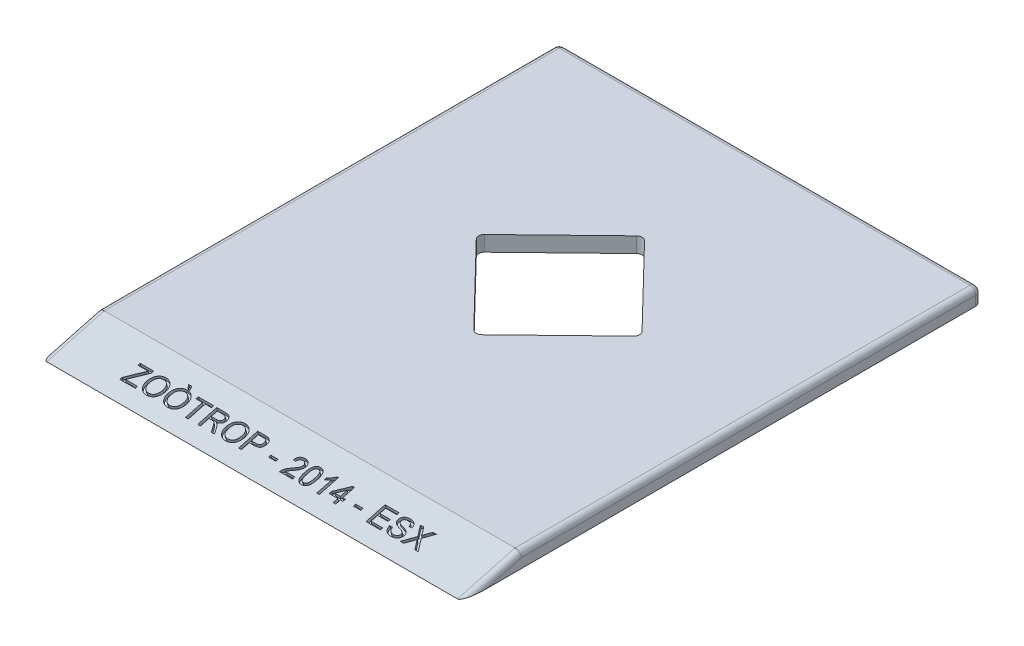
from build123d import *

# Parameters (mm, degrees)
SALIENTE_EXTRUIR1_DEPTH = 55
CROQUIS3_W              = 1.909775432
CROQUIS3_H              = 0.592688927
CORTAR_EXTRUIR1_DEPTH   = 0.8
CORTAR_EXTRUIR2_DEPTH   = 21
REDONDEO1_R             = 1.5
REDONDEO2_R             = 1.5


with BuildPart() as part:
    # Croquis2 → Saliente-Extruir1 (new, symmetric)
    with BuildSketch(Plane(origin=(0, 0, 0), x_dir=(0, 0, -1), z_dir=(1, 0, 0))):
        Polygon((55, 0), (-80, 0), (-65, 4), (55, 4), align=None)
    extrude(amount=SALIENTE_EXTRUIR1_DEPTH, both=True)

    # Croquis3 → Cortar-Extruir1 (cut)
    # profile 1 of 17: a face of its own
    with BuildSketch(Plane(origin=(0, 19.917012448, 5.31120332), x_dir=(1, 0, 0), z_dir=(0, 0.9662349396012462, 0.2576626505603331))):
        with BuildLine():
            Line((-38.821124737, -72.774620472), (-38.821124737, -72.157236173))
            Line((-38.821124737, -72.157236173), (-36.291907058, -68.820274035))
            add(Edge.make_bspline(
                [(-36.291907058, -68.820274035), (-36.248925844, -68.764104905), (-36.166507957, -68.656398756), (-36.050100088, -68.500769581), (-35.9424882, -68.361461879), (-35.875768236, -68.27258562), (-35.844303441, -68.230672029)],
                knots=[0, 0, 0, 0, 1.146521337, 2.198492228, 3.150418105, 4, 4, 4, 4], degree=3))
            Line((-35.844303441, -68.230672029), (-38.491853111, -68.230672029))
            Line((-38.491853111, -68.230672029), (-38.491853111, -67.637983102))
            Line((-38.491853111, -67.637983102), (-34.935719547, -67.637983102))
            Line((-34.935719547, -67.637983102), (-34.935719547, -68.230672029))
            Line((-34.935719547, -68.230672029), (-37.679992757, -71.851630944))
            Line((-37.679992757, -71.851630944), (-37.930033398, -72.181931545))
            Line((-37.930033398, -72.181931545), (-34.804010897, -72.181931545))
            Line((-34.804010897, -72.181931545), (-34.804010897, -72.774620472))
            Line((-34.804010897, -72.774620472), (-38.821124737, -72.774620472))
        make_face()
    # profile 2 of 17: a face of its own
    with BuildSketch(Plane(origin=(0, 19.917012448, 5.31120332), x_dir=(1, 0, 0), z_dir=(0, 0.9662349396012462, 0.2576626505603331))):
        with BuildLine():
            add(Edge.make_bspline(
                [(-34.277176295, -70.27421406), (-34.275390997, -70.171228908), (-34.271912435, -69.970567562), (-34.23941036, -69.678378787), (-34.186635331, -69.40346737), (-34.111188758, -69.145854728), (-34.015560009, -68.905137182), (-33.899304998, -68.680769663), (-33.758926849, -68.475291849), (-33.600123391, -68.286747726), (-33.422747222, -68.120060901), (-33.233892017, -67.972019119), (-33.031199568, -67.848534771), (-32.816542595, -67.746577409), (-32.589009116, -67.668297499), (-32.349237974, -67.613494439), (-32.097485604, -67.578141139), (-31.925406967, -67.574162008), (-31.837479339, -67.572128777)],
                knots=[0, 0, 0, 0, 1.203621547, 2.345195544, 3.432004029, 4.472479546, 5.478447225, 6.455936844, 7.420185704, 8.381829745, 9.332027588, 10.260832629, 11.182364398, 12.100723901, 13.034044877, 13.989196293, 14.972532542, 16, 16, 16, 16], degree=3))
            add(Edge.make_bspline(
                [(-31.837479339, -67.572128777), (-31.779485026, -67.573141467), (-31.664318811, -67.575152486), (-31.49405584, -67.590453654), (-31.328168029, -67.617763589), (-31.166818735, -67.654361964), (-31.009568765, -67.70237744), (-30.856324212, -67.75905825), (-30.70842656, -67.829293753), (-30.564891887, -67.907929388), (-30.427414512, -67.995886747), (-30.29821362, -68.093053062), (-30.177598687, -68.19869347), (-30.063949527, -68.311071529), (-29.961058453, -68.433979844), (-29.864674773, -68.563674415), (-29.777568129, -68.702454938), (-29.699429447, -68.849184341), (-29.629565525, -69.001596416), (-29.569853312, -69.160322848), (-29.518579525, -69.323459604), (-29.475659039, -69.491972277), (-29.444862433, -69.66580326), (-29.420338762, -69.844203531), (-29.407431276, -70.027756162), (-29.405124348, -70.151749236), (-29.403956226, -70.214533578)],
                knots=[0, 0, 0, 0, 1.034375294, 2.054082248, 3.045783978, 4.031219655, 5.002789406, 5.976610191, 6.94273282, 7.920236376, 8.894345378, 9.851183672, 10.800797181, 11.752517031, 12.698794154, 13.65688337, 14.632873302, 15.61821402, 16.620222298, 17.621258913, 18.640965868, 19.669244166, 20.720417492, 21.788124603, 22.880008887, 24, 24, 24, 24], degree=3))
            add(Edge.make_bspline(
                [(-29.403956226, -70.214533578), (-29.40502648, -70.278353234), (-29.407140951, -70.404439971), (-29.421448327, -70.590708658), (-29.446605668, -70.771629957), (-29.479972598, -70.947743343), (-29.524683265, -71.118682185), (-29.577815022, -71.284936574), (-29.642080883, -71.445516266), (-29.714662039, -71.600808292), (-29.796787586, -71.748676848), (-29.887377636, -71.888087966), (-29.986496368, -72.017737565), (-30.092638179, -72.139216116), (-30.208281762, -72.250351355), (-30.332003123, -72.352182478), (-30.463326555, -72.445669867), (-30.602693238, -72.528281593), (-30.747602047, -72.600693721), (-30.895185465, -72.664936325), (-31.04555312, -72.719724974), (-31.199218922, -72.764125728), (-31.355763687, -72.797678134), (-31.514746878, -72.822802529), (-31.676689666, -72.837269242), (-31.785660027, -72.839400788), (-31.84056626, -72.840474797)],
                knots=[0, 0, 0, 0, 1.141429366, 2.255090526, 3.338676798, 4.407031443, 5.458968682, 6.496860253, 7.526652771, 8.550250826, 9.560787671, 10.54935636, 11.521089193, 12.477323897, 13.431786008, 14.386110112, 15.340986122, 16.312041, 17.28047646, 18.236612773, 19.189437236, 20.140779471, 21.09494583, 22.051062463, 23.018000708, 24, 24, 24, 24], degree=3))
            add(Edge.make_bspline(
                [(-31.84056626, -72.840474797), (-31.899602655, -72.839601346), (-32.016538969, -72.837871259), (-32.189373989, -72.820602039), (-32.357909146, -72.794257243), (-32.521654478, -72.756223316), (-32.680386233, -72.706605371), (-32.834292227, -72.646549381), (-32.983913763, -72.576857974), (-33.127394287, -72.495535658), (-33.264245449, -72.405113985), (-33.393140838, -72.306042436), (-33.514009179, -72.199234043), (-33.624911031, -72.082923392), (-33.729438156, -71.961326788), (-33.823411089, -71.829924561), (-33.909898839, -71.691696777), (-33.986342093, -71.545310978), (-34.055397134, -71.395117197), (-34.113577497, -71.241067389), (-34.16470676, -71.08543184), (-34.205426043, -70.927251278), (-34.237874356, -70.766890588), (-34.259693495, -70.604616606), (-34.275451443, -70.440187651), (-34.276598451, -70.329817002), (-34.277176295, -70.27421406)],
                knots=[0, 0, 0, 0, 1.072727997, 2.12480551, 3.153819198, 4.171534612, 5.177148798, 6.173931848, 7.17235114, 8.174500385, 9.168706755, 10.151274001, 11.127173509, 12.097141049, 13.070188938, 14.039134204, 15.03036519, 16.031505612, 17.038625933, 18.033164522, 19.022845559, 20.014762458, 21.000193215, 21.994692725, 22.989758729, 24, 24, 24, 24], degree=3))
        make_face()
        with BuildLine():
            add(Edge.make_bspline(
                [(-33.552778717, -70.282445851), (-33.551668612, -70.356604452), (-33.549503985, -70.501208491), (-33.524739489, -70.71203349), (-33.48716332, -70.910957613), (-33.435368538, -71.098539288), (-33.365743667, -71.27292336), (-33.282498119, -71.435785489), (-33.182828997, -71.586043063), (-33.068935298, -71.72327575), (-32.943665286, -71.846555313), (-32.809801566, -71.954233454), (-32.667314044, -72.04440628), (-32.51778245, -72.118863198), (-32.360132766, -72.176983611), (-32.194837157, -72.217794301), (-32.021774171, -72.243318075), (-31.903766557, -72.246278051), (-31.843653182, -72.24778587)],
                knots=[0, 0, 0, 0, 1.215430442, 2.370003584, 3.475209778, 4.53279855, 5.55522989, 6.548792651, 7.526809858, 8.505409025, 9.467826767, 10.404123909, 11.316848639, 12.227335424, 13.138360512, 14.065900994, 15.014765094, 16, 16, 16, 16], degree=3))
            add(Edge.make_bspline(
                [(-31.843653182, -72.24778587), (-31.782520881, -72.246255749), (-31.66282401, -72.243259777), (-31.487151865, -72.218181567), (-31.320243662, -72.175486985), (-31.160445042, -72.118650823), (-31.010645011, -72.041818022), (-30.867340172, -71.951847233), (-30.734437035, -71.841905505), (-30.608673204, -71.718407909), (-30.495871519, -71.57803021), (-30.39578377, -71.424230356), (-30.314479528, -71.254701742), (-30.244284289, -71.073178851), (-30.192883289, -70.87623083), (-30.1548948, -70.666096584), (-30.132002132, -70.442100176), (-30.129591416, -70.288330798), (-30.128353804, -70.209388708)],
                knots=[0, 0, 0, 0, 0.976878588, 1.912725521, 2.8289017, 3.727303729, 4.617335839, 5.514666588, 6.426584173, 7.368641557, 8.327632997, 9.299405846, 10.294892156, 11.327373912, 12.405931897, 13.542618837, 14.738430195, 16, 16, 16, 16], degree=3))
            add(Edge.make_bspline(
                [(-30.128353804, -70.209388708), (-30.128791175, -70.158602506), (-30.129649141, -70.058978356), (-30.141011478, -69.912131219), (-30.155667435, -69.769851869), (-30.177981357, -69.632323897), (-30.208732773, -69.500116837), (-30.242800119, -69.372224196), (-30.285400145, -69.24974808), (-30.33373581, -69.132208186), (-30.387822602, -69.02020794), (-30.44882531, -68.914691551), (-30.516034957, -68.816069241), (-30.587638148, -68.722471233), (-30.667599864, -68.637520152), (-30.752069901, -68.557627625), (-30.842966992, -68.484444249), (-30.939384017, -68.417950908), (-31.039953178, -68.358096421), (-31.144467149, -68.306868747), (-31.251260876, -68.261871671), (-31.362121934, -68.227379524), (-31.475519546, -68.199561102), (-31.591912126, -68.178430418), (-31.71173169, -68.167487967), (-31.792528374, -68.165714184), (-31.833363443, -68.164817704)],
                knots=[0, 0, 0, 0, 1.220438779, 2.394059227, 3.538503547, 4.658058814, 5.74010225, 6.800155734, 7.837851593, 8.854470756, 9.853724944, 10.825214244, 11.781044712, 12.72106398, 13.654479919, 14.581868691, 15.514082315, 16.456304431, 17.39516604, 18.324312202, 19.252140633, 20.177768678, 21.111585046, 22.057694709, 23.018348693, 24, 24, 24, 24], degree=3))
            add(Edge.make_bspline(
                [(-31.833363443, -68.164817704), (-31.891078243, -68.165963897), (-32.004955973, -68.168225464), (-32.172597549, -68.19336629), (-32.334222205, -68.23093012), (-32.490080764, -68.283446355), (-32.638840193, -68.352986104), (-32.781271202, -68.43826709), (-32.918638074, -68.536967245), (-33.04877473, -68.651491376), (-33.170090558, -68.783051647), (-33.27265092, -68.938157175), (-33.359091595, -69.113105265), (-33.431267966, -69.307452465), (-33.486300323, -69.522703865), (-33.524334566, -69.757933137), (-33.548348611, -70.013388156), (-33.551264263, -70.19046713), (-33.552778717, -70.282445851)],
                knots=[0, 0, 0, 0, 0.895090134, 1.766112571, 2.624765742, 3.468151641, 4.313618154, 5.168136083, 6.041303099, 6.935189387, 7.854749729, 8.809996334, 9.809869957, 10.877771942, 12.021723904, 13.25217762, 14.572720513, 16, 16, 16, 16], degree=3))
        make_face(mode=Mode.SUBTRACT)
    # profile 3 of 17: a face of its own
    with BuildSketch(Plane(origin=(0, 19.917012448, 5.31120332), x_dir=(1, 0, 0), z_dir=(0, 0.9662349396012462, 0.2576626505603331))):
        with BuildLine():
            add(Edge.make_bspline(
                [(-28.745412973, -70.27421406), (-28.743627676, -70.171228908), (-28.740149114, -69.970567562), (-28.707647038, -69.678378787), (-28.65487201, -69.40346737), (-28.579425436, -69.145854728), (-28.483796688, -68.905137182), (-28.367541676, -68.680769663), (-28.227163528, -68.475291849), (-28.06836007, -68.286747726), (-27.890983901, -68.120060901), (-27.702128696, -67.972019119), (-27.499436246, -67.848534771), (-27.284779274, -67.746577409), (-27.057245795, -67.668297499), (-26.817474653, -67.613494439), (-26.565722282, -67.578141139), (-26.393643645, -67.574162008), (-26.305716017, -67.572128777)],
                knots=[0, 0, 0, 0, 1.203621547, 2.345195544, 3.432004029, 4.472479546, 5.478447225, 6.455936844, 7.420185704, 8.381829745, 9.332027588, 10.260832629, 11.182364398, 12.100723901, 13.034044877, 13.989196293, 14.972532542, 16, 16, 16, 16], degree=3))
            add(Edge.make_bspline(
                [(-26.305716017, -67.572128777), (-26.247721705, -67.573141467), (-26.132555489, -67.575152486), (-25.962292519, -67.590453654), (-25.796404707, -67.617763589), (-25.635055414, -67.654361964), (-25.477805443, -67.70237744), (-25.32456089, -67.75905825), (-25.176663239, -67.829293753), (-25.033128566, -67.907929388), (-24.895651191, -67.995886747), (-24.766450299, -68.093053062), (-24.645835365, -68.19869347), (-24.532186206, -68.311071529), (-24.429295132, -68.433979844), (-24.332911452, -68.563674415), (-24.245804808, -68.702454938), (-24.167666126, -68.849184341), (-24.097802204, -69.001596416), (-24.038089991, -69.160322848), (-23.986816204, -69.323459604), (-23.943895718, -69.491972277), (-23.913099111, -69.66580326), (-23.888575441, -69.844203531), (-23.875667955, -70.027756162), (-23.873361026, -70.151749236), (-23.872192904, -70.214533578)],
                knots=[0, 0, 0, 0, 1.034375294, 2.054082248, 3.045783978, 4.031219655, 5.002789406, 5.976610191, 6.94273282, 7.920236376, 8.894345378, 9.851183672, 10.800797181, 11.752517031, 12.698794154, 13.65688337, 14.632873302, 15.61821402, 16.620222298, 17.621258913, 18.640965868, 19.669244166, 20.720417492, 21.788124603, 22.880008887, 24, 24, 24, 24], degree=3))
            add(Edge.make_bspline(
                [(-23.872192904, -70.214533578), (-23.873263158, -70.278353234), (-23.875377629, -70.404439971), (-23.889685006, -70.590708658), (-23.914842347, -70.771629957), (-23.948209276, -70.947743343), (-23.992919943, -71.118682185), (-24.0460517, -71.284936574), (-24.110317562, -71.445516266), (-24.182898717, -71.600808292), (-24.265024264, -71.748676848), (-24.355614315, -71.888087966), (-24.454733047, -72.017737565), (-24.560874858, -72.139216116), (-24.67651844, -72.250351355), (-24.800239802, -72.352182478), (-24.931563234, -72.445669867), (-25.070929917, -72.528281593), (-25.215838726, -72.600693721), (-25.363422144, -72.664936325), (-25.513789798, -72.719724974), (-25.667455601, -72.764125728), (-25.824000365, -72.797678134), (-25.982983557, -72.822802529), (-26.144926345, -72.837269242), (-26.253896706, -72.839400788), (-26.308802939, -72.840474797)],
                knots=[0, 0, 0, 0, 1.141429366, 2.255090526, 3.338676798, 4.407031443, 5.458968682, 6.496860253, 7.526652771, 8.550250826, 9.560787671, 10.54935636, 11.521089193, 12.477323897, 13.431786008, 14.386110112, 15.340986122, 16.312041, 17.28047646, 18.236612773, 19.189437236, 20.140779471, 21.09494583, 22.051062463, 23.018000708, 24, 24, 24, 24], degree=3))
            add(Edge.make_bspline(
                [(-26.308802939, -72.840474797), (-26.367839334, -72.839601346), (-26.484775647, -72.837871259), (-26.657610668, -72.820602039), (-26.826145825, -72.794257243), (-26.989891157, -72.756223316), (-27.148622911, -72.706605371), (-27.302528905, -72.646549381), (-27.452150442, -72.576857974), (-27.595630966, -72.495535658), (-27.732482127, -72.405113985), (-27.861377516, -72.306042436), (-27.982245858, -72.199234043), (-28.09314771, -72.082923392), (-28.197674834, -71.961326788), (-28.291647767, -71.829924561), (-28.378135518, -71.691696777), (-28.454578772, -71.545310978), (-28.523633812, -71.395117197), (-28.581814175, -71.241067389), (-28.632943439, -71.08543184), (-28.673662721, -70.927251278), (-28.706111034, -70.766890588), (-28.727930174, -70.604616606), (-28.743688122, -70.440187651), (-28.744835129, -70.329817002), (-28.745412973, -70.27421406)],
                knots=[0, 0, 0, 0, 1.072727997, 2.12480551, 3.153819198, 4.171534612, 5.177148798, 6.173931848, 7.17235114, 8.174500385, 9.168706755, 10.151274001, 11.127173509, 12.097141049, 13.070188938, 14.039134204, 15.03036519, 16.031505612, 17.038625933, 18.033164522, 19.022845559, 20.014762458, 21.000193215, 21.994692725, 22.989758729, 24, 24, 24, 24], degree=3))
        make_face()
        with BuildLine():
            add(Edge.make_bspline(
                [(-28.021015395, -70.282445851), (-28.019905291, -70.356604452), (-28.017740664, -70.501208491), (-27.992976167, -70.71203349), (-27.955399999, -70.910957613), (-27.903605217, -71.098539288), (-27.833980346, -71.27292336), (-27.750734798, -71.435785489), (-27.651065676, -71.586043063), (-27.537171977, -71.72327575), (-27.411901965, -71.846555313), (-27.278038244, -71.954233454), (-27.135550723, -72.04440628), (-26.986019128, -72.118863198), (-26.828369445, -72.176983611), (-26.663073836, -72.217794301), (-26.49001085, -72.243318075), (-26.372003236, -72.246278051), (-26.31188986, -72.24778587)],
                knots=[0, 0, 0, 0, 1.215430442, 2.370003584, 3.475209778, 4.53279855, 5.55522989, 6.548792651, 7.526809858, 8.505409025, 9.467826767, 10.404123909, 11.316848639, 12.227335424, 13.138360512, 14.065900994, 15.014765094, 16, 16, 16, 16], degree=3))
            add(Edge.make_bspline(
                [(-26.31188986, -72.24778587), (-26.25075756, -72.246255749), (-26.131060688, -72.243259777), (-25.955388543, -72.218181567), (-25.78848034, -72.175486985), (-25.628681721, -72.118650823), (-25.478881689, -72.041818022), (-25.335576851, -71.951847233), (-25.202673714, -71.841905505), (-25.076909882, -71.718407909), (-24.964108197, -71.57803021), (-24.864020449, -71.424230356), (-24.782716207, -71.254701742), (-24.712520967, -71.073178851), (-24.661119967, -70.87623083), (-24.623131479, -70.666096584), (-24.600238811, -70.442100176), (-24.597828095, -70.288330798), (-24.596590482, -70.209388708)],
                knots=[0, 0, 0, 0, 0.976878588, 1.912725521, 2.8289017, 3.727303729, 4.617335839, 5.514666588, 6.426584173, 7.368641557, 8.327632997, 9.299405846, 10.294892156, 11.327373912, 12.405931897, 13.542618837, 14.738430195, 16, 16, 16, 16], degree=3))
            add(Edge.make_bspline(
                [(-24.596590482, -70.209388708), (-24.597027854, -70.158602506), (-24.59788582, -70.058978356), (-24.609248157, -69.912131219), (-24.623904113, -69.769851869), (-24.646218035, -69.632323897), (-24.676969451, -69.500116837), (-24.711036798, -69.372224196), (-24.753636823, -69.24974808), (-24.801972489, -69.132208186), (-24.856059281, -69.02020794), (-24.917061988, -68.914691551), (-24.984271635, -68.816069241), (-25.055874827, -68.722471233), (-25.135836543, -68.637520152), (-25.220306579, -68.557627625), (-25.31120367, -68.484444249), (-25.407620696, -68.417950908), (-25.508189856, -68.358096421), (-25.612703828, -68.306868747), (-25.719497555, -68.261871671), (-25.830358613, -68.227379524), (-25.943756225, -68.199561102), (-26.060148804, -68.178430418), (-26.179968369, -68.167487967), (-26.260765053, -68.165714184), (-26.301600122, -68.164817704)],
                knots=[0, 0, 0, 0, 1.220438779, 2.394059227, 3.538503547, 4.658058814, 5.74010225, 6.800155734, 7.837851593, 8.854470756, 9.853724944, 10.825214244, 11.781044712, 12.72106398, 13.654479919, 14.581868691, 15.514082315, 16.456304431, 17.39516604, 18.324312202, 19.252140633, 20.177768678, 21.111585046, 22.057694709, 23.018348693, 24, 24, 24, 24], degree=3))
            add(Edge.make_bspline(
                [(-26.301600122, -68.164817704), (-26.359314922, -68.165963897), (-26.473192652, -68.168225464), (-26.640834228, -68.19336629), (-26.802458884, -68.23093012), (-26.958317443, -68.283446355), (-27.107076872, -68.352986104), (-27.249507881, -68.43826709), (-27.386874753, -68.536967245), (-27.517011408, -68.651491376), (-27.638327236, -68.783051647), (-27.740887598, -68.938157175), (-27.827328273, -69.113105265), (-27.899504644, -69.307452465), (-27.954537002, -69.522703865), (-27.992571245, -69.757933137), (-28.016585289, -70.013388156), (-28.019500942, -70.19046713), (-28.021015395, -70.282445851)],
                knots=[0, 0, 0, 0, 0.895090134, 1.766112571, 2.624765742, 3.468151641, 4.313618154, 5.168136083, 6.041303099, 6.935189387, 7.854749729, 8.809996334, 9.809869957, 10.877771942, 12.021723904, 13.25217762, 14.572720513, 16, 16, 16, 16], degree=3))
        make_face(mode=Mode.SUBTRACT)
    # profile 4 of 17: a face of its own
    with BuildSketch(Plane(origin=(0, 19.917012448, 5.31120332), x_dir=(1, 0, 0), z_dir=(0, 0.9662349396012462, 0.2576626505603331))):
        Polygon((-25.847822662, -67.374565801), (-26.308802939, -67.374565801), (-27.099054842, -66.386750922), (-26.242948614, -66.386750922), align=None)
    # profile 5 of 17: a face of its own
    with BuildSketch(Plane(origin=(0, 19.917012448, 5.31120332), x_dir=(1, 0, 0), z_dir=(0, 0.9662349396012462, 0.2576626505603331))):
        Polygon((-21.699000171, -72.774620472), (-21.699000171, -68.230672029), (-23.345358302, -68.230672029), (-23.345358302, -67.637983102), (-19.328244462, -67.637983102), (-19.328244462, -68.230672029), (-20.974602593, -68.230672029), (-20.974602593, -72.774620472), align=None)
    # profile 6 of 17: a face of its own
    with BuildSketch(Plane(origin=(0, 19.917012448, 5.31120332), x_dir=(1, 0, 0), z_dir=(0, 0.9662349396012462, 0.2576626505603331))):
        with BuildLine():
            Line((-18.537992559, -72.774620472), (-18.537992559, -67.637983102))
            Line((-18.537992559, -67.637983102), (-16.309235239, -67.637983102))
            add(Edge.make_bspline(
                [(-16.309235239, -67.637983102), (-16.256754828, -67.638394308), (-16.155185136, -67.639190148), (-16.007888111, -67.644823796), (-15.870401105, -67.656968462), (-15.742471324, -67.670101225), (-15.624121499, -67.690258263), (-15.515473728, -67.71337793), (-15.416360264, -67.740890684), (-15.326338009, -67.773385367), (-15.242816987, -67.810148233), (-15.165399308, -67.855507674), (-15.090866819, -67.905211949), (-15.021985681, -67.963607055), (-14.956939147, -68.027544291), (-14.895787505, -68.097892429), (-14.839436055, -68.175261947), (-14.769933291, -68.285993772), (-14.695370995, -68.433465244), (-14.633248891, -68.622196775), (-14.59319367, -68.819616845), (-14.588907646, -68.954530593), (-14.586733044, -69.02298188)],
                knots=[0, 0, 0, 0, 1.242255013, 2.404239178, 3.487702428, 4.508875116, 5.447164253, 6.327763259, 7.137389581, 7.87956647, 8.591787438, 9.293660819, 10.000726923, 10.709654955, 11.427269343, 12.158170644, 12.913245971, 13.690346794, 15.251572448, 16.809945773, 18.381459854, 20, 20, 20, 20], degree=3))
            add(Edge.make_bspline(
                [(-14.586733044, -69.02298188), (-14.587738194, -69.066921502), (-14.589723436, -69.153705267), (-14.604930586, -69.281300633), (-14.632446696, -69.403212873), (-14.667730683, -69.520509675), (-14.716023698, -69.631529129), (-14.77196906, -69.738538842), (-14.841277409, -69.838598972), (-14.918875769, -69.934373959), (-15.00786028, -70.023812559), (-15.109013736, -70.103688047), (-15.221333425, -70.175536209), (-15.345348329, -70.237374725), (-15.479630911, -70.293898064), (-15.625866049, -70.339413381), (-15.783463549, -70.376580127), (-15.892717463, -70.3945777), (-15.949094397, -70.403864763)],
                knots=[0, 0, 0, 0, 0.982609109, 1.940720374, 2.867584677, 3.775009516, 4.675469332, 5.571146231, 6.471115823, 7.392408543, 8.32534739, 9.286126426, 10.269214477, 11.301811357, 12.381622301, 13.524260118, 14.722474812, 16, 16, 16, 16], degree=3))
            add(Edge.make_bspline(
                [(-15.949094397, -70.403864763), (-15.90773978, -70.424756203), (-15.829205872, -70.464429801), (-15.720474704, -70.526637658), (-15.628307057, -70.590198758), (-15.574909669, -70.635659525), (-15.549852551, -70.656992325)],
                knots=[0, 0, 0, 0, 1.172304973, 2.226249348, 3.167654437, 4, 4, 4, 4], degree=3))
            add(Edge.make_bspline(
                [(-15.549852551, -70.656992325), (-15.501328026, -70.70456054), (-15.401655205, -70.802269032), (-15.264301728, -70.968695217), (-15.131132815, -71.153953099), (-15.05022266, -71.287839597), (-15.008612315, -71.356694531)],
                knots=[0, 0, 0, 0, 0.918110279, 1.885863737, 2.912745394, 4, 4, 4, 4], degree=3))
            Line((-15.008612315, -71.356694531), (-14.165882746, -72.774620472))
            Line((-14.165882746, -72.774620472), (-14.996264629, -72.774620472))
            Line((-14.996264629, -72.774620472), (-15.636286352, -71.690082053))
            add(Edge.make_bspline(
                [(-15.636286352, -71.690082053), (-15.659298319, -71.652029719), (-15.703891731, -71.578290544), (-15.768305318, -71.470598028), (-15.831460721, -71.371449908), (-15.890036278, -71.278012477), (-15.946409082, -71.191982046), (-16.00003444, -71.11305976), (-16.049436558, -71.040210264), (-16.110627469, -70.955394492), (-16.181843525, -70.861545053), (-16.264947777, -70.764897853), (-16.344087664, -70.687842328), (-16.441549895, -70.612281189), (-16.562271614, -70.541606444), (-16.664887354, -70.50913334), (-16.714650928, -70.493385486)],
                knots=[0, 0, 0, 0, 1.130940588, 2.191577161, 3.191089816, 4.120344442, 4.99615009, 5.80661983, 6.546979556, 7.234477901, 8.466216387, 9.541989141, 10.473533583, 11.269175393, 12.675684693, 14, 14, 14, 14], degree=3))
            add(Edge.make_bspline(
                [(-16.714650928, -70.493385486), (-16.73552988, -70.489620302), (-16.783197153, -70.481024272), (-16.864136062, -70.475410192), (-16.962203481, -70.469451597), (-17.033274611, -70.46962521), (-17.071704848, -70.469719088)],
                knots=[0, 0, 0, 0, 0.709978628, 1.620902492, 2.713552433, 4, 4, 4, 4], degree=3))
            Line((-17.071704848, -70.469719088), (-17.813594981, -70.469719088))
            Line((-17.813594981, -70.469719088), (-17.813594981, -72.774620472))
            Line((-17.813594981, -72.774620472), (-18.537992559, -72.774620472))
        make_face()
        with BuildLine():
            Line((-17.813594981, -69.877030161), (-16.437856968, -69.877030161))
            add(Edge.make_bspline(
                [(-16.437856968, -69.877030161), (-16.368872253, -69.875950829), (-16.239911798, -69.873933121), (-16.059581004, -69.85670401), (-15.905899043, -69.829326221), (-15.775827844, -69.78939251), (-15.666547505, -69.733951258), (-15.571504318, -69.666385732), (-15.492522233, -69.581752877), (-15.426817298, -69.486262719), (-15.375743503, -69.381180567), (-15.338901304, -69.270807172), (-15.314787444, -69.156070153), (-15.312360358, -69.077981726), (-15.311130621, -69.038416488)],
                knots=[0, 0, 0, 0, 1.546323217, 2.890706218, 4.056530419, 5.041445823, 5.928701482, 6.793137403, 7.641659452, 8.509781392, 9.383301667, 10.251423607, 11.114044887, 12, 12, 12, 12], degree=3))
            add(Edge.make_bspline(
                [(-15.311130621, -69.038416488), (-15.312086691, -69.009583794), (-15.313959349, -68.953109017), (-15.323776443, -68.870219725), (-15.342863206, -68.791455738), (-15.368067229, -68.716400701), (-15.401744918, -68.645604339), (-15.441752639, -68.578518058), (-15.489494201, -68.515513678), (-15.544179413, -68.456399277), (-15.606967975, -68.402610949), (-15.678687273, -68.356203288), (-15.758771663, -68.316766788), (-15.847314228, -68.285467345), (-15.944036045, -68.260432886), (-16.049487728, -68.243778268), (-16.163187025, -68.231727042), (-16.241974045, -68.23103027), (-16.282481919, -68.230672029)],
                knots=[0, 0, 0, 0, 0.965208469, 1.890559848, 2.786986821, 3.67262109, 4.535197034, 5.405224191, 6.282113641, 7.175449223, 8.095446547, 9.040936516, 10.026471658, 11.075712529, 12.17809725, 13.364958037, 14.645208957, 16, 16, 16, 16], degree=3))
            Line((-16.282481919, -68.230672029), (-17.813594981, -68.230672029))
            Line((-17.813594981, -68.230672029), (-17.813594981, -69.877030161))
        make_face(mode=Mode.SUBTRACT)
    # profile 7 of 17: a face of its own
    with BuildSketch(Plane(origin=(0, 19.917012448, 5.31120332), x_dir=(1, 0, 0), z_dir=(0, 0.9662349396012462, 0.2576626505603331))):
        with BuildLine():
            add(Edge.make_bspline(
                [(-13.66477249, -70.27421406), (-13.662987193, -70.171228908), (-13.659508631, -69.970567562), (-13.627006555, -69.678378787), (-13.574231527, -69.40346737), (-13.498784953, -69.145854728), (-13.403156205, -68.905137182), (-13.286901193, -68.680769663), (-13.146523045, -68.475291849), (-12.987719586, -68.286747726), (-12.810343418, -68.120060901), (-12.621488213, -67.972019119), (-12.418795763, -67.848534771), (-12.204138791, -67.746577409), (-11.976605312, -67.668297499), (-11.73683417, -67.613494439), (-11.485081799, -67.578141139), (-11.313003162, -67.574162008), (-11.225075534, -67.572128777)],
                knots=[0, 0, 0, 0, 1.203621547, 2.345195544, 3.432004029, 4.472479546, 5.478447225, 6.455936844, 7.420185704, 8.381829745, 9.332027588, 10.260832629, 11.182364398, 12.100723901, 13.034044877, 13.989196293, 14.972532542, 16, 16, 16, 16], degree=3))
            add(Edge.make_bspline(
                [(-11.225075534, -67.572128777), (-11.167081222, -67.573141467), (-11.051915006, -67.575152486), (-10.881652036, -67.590453654), (-10.715764224, -67.617763589), (-10.55441493, -67.654361964), (-10.39716496, -67.70237744), (-10.243920407, -67.75905825), (-10.096022756, -67.829293753), (-9.952488083, -67.907929388), (-9.815010708, -67.995886747), (-9.685809816, -68.093053062), (-9.565194882, -68.19869347), (-9.451545723, -68.311071529), (-9.348654649, -68.433979844), (-9.252270969, -68.563674415), (-9.165164325, -68.702454938), (-9.087025643, -68.849184341), (-9.017161721, -69.001596416), (-8.957449508, -69.160322848), (-8.906175721, -69.323459604), (-8.863255235, -69.491972277), (-8.832458628, -69.66580326), (-8.807934957, -69.844203531), (-8.795027472, -70.027756162), (-8.792720543, -70.151749236), (-8.791552421, -70.214533578)],
                knots=[0, 0, 0, 0, 1.034375294, 2.054082248, 3.045783978, 4.031219655, 5.002789406, 5.976610191, 6.94273282, 7.920236376, 8.894345378, 9.851183672, 10.800797181, 11.752517031, 12.698794154, 13.65688337, 14.632873302, 15.61821402, 16.620222298, 17.621258913, 18.640965868, 19.669244166, 20.720417492, 21.788124603, 22.880008887, 24, 24, 24, 24], degree=3))
            add(Edge.make_bspline(
                [(-8.791552421, -70.214533578), (-8.792622675, -70.278353234), (-8.794737146, -70.404439971), (-8.809044523, -70.590708658), (-8.834201864, -70.771629957), (-8.867568793, -70.947743343), (-8.91227946, -71.118682185), (-8.965411217, -71.284936574), (-9.029677079, -71.445516266), (-9.102258234, -71.600808292), (-9.184383781, -71.748676848), (-9.274973832, -71.888087966), (-9.374092564, -72.017737565), (-9.480234375, -72.139216116), (-9.595877957, -72.250351355), (-9.719599318, -72.352182478), (-9.850922751, -72.445669867), (-9.990289434, -72.528281593), (-10.135198243, -72.600693721), (-10.28278166, -72.664936325), (-10.433149315, -72.719724974), (-10.586815118, -72.764125728), (-10.743359882, -72.797678134), (-10.902343074, -72.822802529), (-11.064285861, -72.837269242), (-11.173256223, -72.839400788), (-11.228162456, -72.840474797)],
                knots=[0, 0, 0, 0, 1.141429366, 2.255090526, 3.338676798, 4.407031443, 5.458968682, 6.496860253, 7.526652771, 8.550250826, 9.560787671, 10.54935636, 11.521089193, 12.477323897, 13.431786008, 14.386110112, 15.340986122, 16.312041, 17.28047646, 18.236612773, 19.189437236, 20.140779471, 21.09494583, 22.051062463, 23.018000708, 24, 24, 24, 24], degree=3))
            add(Edge.make_bspline(
                [(-11.228162456, -72.840474797), (-11.287198851, -72.839601346), (-11.404135164, -72.837871259), (-11.576970185, -72.820602039), (-11.745505342, -72.794257243), (-11.909250674, -72.756223316), (-12.067982428, -72.706605371), (-12.221888422, -72.646549381), (-12.371509959, -72.576857974), (-12.514990483, -72.495535658), (-12.651841644, -72.405113985), (-12.780737033, -72.306042436), (-12.901605375, -72.199234043), (-13.012507227, -72.082923392), (-13.117034351, -71.961326788), (-13.211007284, -71.829924561), (-13.297495035, -71.691696777), (-13.373938289, -71.545310978), (-13.442993329, -71.395117197), (-13.501173692, -71.241067389), (-13.552302955, -71.08543184), (-13.593022238, -70.927251278), (-13.625470551, -70.766890588), (-13.64728969, -70.604616606), (-13.663047639, -70.440187651), (-13.664194646, -70.329817002), (-13.66477249, -70.27421406)],
                knots=[0, 0, 0, 0, 1.072727997, 2.12480551, 3.153819198, 4.171534612, 5.177148798, 6.173931848, 7.17235114, 8.174500385, 9.168706755, 10.151274001, 11.127173509, 12.097141049, 13.070188938, 14.039134204, 15.03036519, 16.031505612, 17.038625933, 18.033164522, 19.022845559, 20.014762458, 21.000193215, 21.994692725, 22.989758729, 24, 24, 24, 24], degree=3))
        make_face()
        with BuildLine():
            add(Edge.make_bspline(
                [(-12.940374912, -70.282445851), (-12.939264807, -70.356604452), (-12.937100181, -70.501208491), (-12.912335684, -70.71203349), (-12.874759516, -70.910957613), (-12.822964734, -71.098539288), (-12.753339863, -71.27292336), (-12.670094315, -71.435785489), (-12.570425192, -71.586043063), (-12.456531494, -71.72327575), (-12.331261482, -71.846555313), (-12.197397761, -71.954233454), (-12.05491024, -72.04440628), (-11.905378645, -72.118863198), (-11.747728962, -72.176983611), (-11.582433353, -72.217794301), (-11.409370367, -72.243318075), (-11.291362753, -72.246278051), (-11.231249377, -72.24778587)],
                knots=[0, 0, 0, 0, 1.215430442, 2.370003584, 3.475209778, 4.53279855, 5.55522989, 6.548792651, 7.526809858, 8.505409025, 9.467826767, 10.404123909, 11.316848639, 12.227335424, 13.138360512, 14.065900994, 15.014765094, 16, 16, 16, 16], degree=3))
            add(Edge.make_bspline(
                [(-11.231249377, -72.24778587), (-11.170117077, -72.246255749), (-11.050420205, -72.243259777), (-10.87474806, -72.218181567), (-10.707839857, -72.175486985), (-10.548041238, -72.118650823), (-10.398241206, -72.041818022), (-10.254936368, -71.951847233), (-10.122033231, -71.841905505), (-9.996269399, -71.718407909), (-9.883467714, -71.57803021), (-9.783379966, -71.424230356), (-9.702075724, -71.254701742), (-9.631880484, -71.073178851), (-9.580479484, -70.87623083), (-9.542490995, -70.666096584), (-9.519598328, -70.442100176), (-9.517187612, -70.288330798), (-9.515949999, -70.209388708)],
                knots=[0, 0, 0, 0, 0.976878588, 1.912725521, 2.8289017, 3.727303729, 4.617335839, 5.514666588, 6.426584173, 7.368641557, 8.327632997, 9.299405846, 10.294892156, 11.327373912, 12.405931897, 13.542618837, 14.738430195, 16, 16, 16, 16], degree=3))
            add(Edge.make_bspline(
                [(-9.515949999, -70.209388708), (-9.516387371, -70.158602506), (-9.517245336, -70.058978356), (-9.528607673, -69.912131219), (-9.54326363, -69.769851869), (-9.565577552, -69.632323897), (-9.596328968, -69.500116837), (-9.630396315, -69.372224196), (-9.67299634, -69.24974808), (-9.721332006, -69.132208186), (-9.775418798, -69.02020794), (-9.836421505, -68.914691551), (-9.903631152, -68.816069241), (-9.975234344, -68.722471233), (-10.05519606, -68.637520152), (-10.139666096, -68.557627625), (-10.230563187, -68.484444249), (-10.326980213, -68.417950908), (-10.427549373, -68.358096421), (-10.532063345, -68.306868747), (-10.638857072, -68.261871671), (-10.74971813, -68.227379524), (-10.863115742, -68.199561102), (-10.979508321, -68.178430418), (-11.099327886, -68.167487967), (-11.18012457, -68.165714184), (-11.220959639, -68.164817704)],
                knots=[0, 0, 0, 0, 1.220438779, 2.394059227, 3.538503547, 4.658058814, 5.74010225, 6.800155734, 7.837851593, 8.854470756, 9.853724944, 10.825214244, 11.781044712, 12.72106398, 13.654479919, 14.581868691, 15.514082315, 16.456304431, 17.39516604, 18.324312202, 19.252140633, 20.177768678, 21.111585046, 22.057694709, 23.018348693, 24, 24, 24, 24], degree=3))
            add(Edge.make_bspline(
                [(-11.220959639, -68.164817704), (-11.278674438, -68.165963897), (-11.392552169, -68.168225464), (-11.560193745, -68.19336629), (-11.7218184, -68.23093012), (-11.87767696, -68.283446355), (-12.026436389, -68.352986104), (-12.168867398, -68.43826709), (-12.30623427, -68.536967245), (-12.436370925, -68.651491376), (-12.557686753, -68.783051647), (-12.660247115, -68.938157175), (-12.74668779, -69.113105265), (-12.818864161, -69.307452465), (-12.873896519, -69.522703865), (-12.911930761, -69.757933137), (-12.935944806, -70.013388156), (-12.938860458, -70.19046713), (-12.940374912, -70.282445851)],
                knots=[0, 0, 0, 0, 0.895090134, 1.766112571, 2.624765742, 3.468151641, 4.313618154, 5.168136083, 6.041303099, 6.935189387, 7.854749729, 8.809996334, 9.809869957, 10.877771942, 12.021723904, 13.25217762, 14.572720513, 16, 16, 16, 16], degree=3))
        make_face(mode=Mode.SUBTRACT)
    # profile 8 of 17: a face of its own
    with BuildSketch(Plane(origin=(0, 19.917012448, 5.31120332), x_dir=(1, 0, 0), z_dir=(0, 0.9662349396012462, 0.2576626505603331))):
        with BuildLine():
            Line((-7.869591868, -72.774620472), (-7.869591868, -67.637983102))
            Line((-7.869591868, -67.637983102), (-5.98245386, -67.637983102))
            add(Edge.make_bspline(
                [(-5.98245386, -67.637983102), (-5.90423351, -67.63842873), (-5.757335327, -67.639265621), (-5.552193902, -67.64906669), (-5.376035629, -67.661192235), (-5.269635324, -67.678455857), (-5.221013224, -67.686344872)],
                knots=[0, 0, 0, 0, 1.22865052, 2.30741144, 3.226532197, 4, 4, 4, 4], degree=3))
            add(Edge.make_bspline(
                [(-5.221013224, -67.686344872), (-5.161706, -67.69775868), (-5.046752067, -67.719881821), (-4.883995117, -67.773215916), (-4.735714106, -67.839586125), (-4.602140771, -67.922276558), (-4.481056045, -68.01941759), (-4.374185523, -68.135815349), (-4.279452872, -68.268870879), (-4.198901181, -68.418480072), (-4.13185424, -68.579459499), (-4.084894301, -68.75095829), (-4.054816376, -68.929996889), (-4.051650475, -69.052355997), (-4.050041003, -69.114560551)],
                knots=[0, 0, 0, 0, 1.070909925, 2.075721949, 3.031861647, 3.947440733, 4.85625699, 5.777986723, 6.742441087, 7.747548058, 8.78749499, 9.830146138, 10.896896232, 12, 12, 12, 12], degree=3))
            add(Edge.make_bspline(
                [(-4.050041003, -69.114560551), (-4.051175264, -69.167782745), (-4.053406985, -69.272500327), (-4.072570418, -69.426345567), (-4.102795294, -69.574350943), (-4.147879796, -69.715503632), (-4.202996811, -69.851453847), (-4.272456986, -69.979908754), (-4.353566872, -70.102612664), (-4.446625083, -70.219231689), (-4.556180443, -70.327399362), (-4.687989008, -70.419158367), (-4.839509498, -70.496210137), (-5.010777251, -70.558467134), (-5.201376512, -70.607453358), (-5.411931784, -70.643344868), (-5.642853237, -70.663159968), (-5.803375286, -70.665872846), (-5.886759293, -70.667282064)],
                knots=[0, 0, 0, 0, 0.928769099, 1.82740408, 2.702266355, 3.562020322, 4.410419678, 5.259600434, 6.10654066, 6.975254961, 7.860221694, 8.783881459, 9.766664779, 10.81996744, 11.958551584, 13.197863772, 14.544415867, 16, 16, 16, 16], degree=3))
            Line((-5.886759293, -70.667282064), (-7.14519429, -70.667282064))
            Line((-7.14519429, -70.667282064), (-7.14519429, -72.774620472))
            Line((-7.14519429, -72.774620472), (-7.869591868, -72.774620472))
        make_face()
        with BuildLine():
            Line((-7.14519429, -70.074593136), (-5.906309796, -70.074593136))
            add(Edge.make_bspline(
                [(-5.906309796, -70.074593136), (-5.856898214, -70.073766956), (-5.761711381, -70.072175396), (-5.624170748, -70.061068626), (-5.497942386, -70.041843318), (-5.382676149, -70.015029643), (-5.278225264, -69.981701014), (-5.184776618, -69.939549472), (-5.102812094, -69.888986302), (-5.031788575, -69.830526748), (-4.970822899, -69.765037785), (-4.917997591, -69.693592941), (-4.873114353, -69.615681661), (-4.837931199, -69.530977972), (-4.808126216, -69.441129526), (-4.789522526, -69.344274656), (-4.776587439, -69.2418179), (-4.77516491, -69.171197899), (-4.774438581, -69.135140028)],
                knots=[0, 0, 0, 0, 1.403696362, 2.704090955, 3.91683431, 5.027708188, 6.063065288, 7.026749679, 7.932587242, 8.790956304, 9.632005367, 10.468072405, 11.310475089, 12.179234342, 13.069796908, 13.994719932, 14.976123913, 16, 16, 16, 16], degree=3))
            add(Edge.make_bspline(
                [(-4.774438581, -69.135140028), (-4.775973051, -69.082850363), (-4.778946317, -68.981531251), (-4.808902717, -68.835736167), (-4.855868025, -68.701018925), (-4.923108523, -68.579930146), (-5.004489085, -68.473703036), (-5.100150211, -68.386791774), (-5.207024979, -68.317309424), (-5.286822763, -68.289797801), (-5.326997529, -68.275946878)],
                knots=[0, 0, 0, 0, 1.143156811, 2.215038775, 3.243253804, 4.254666983, 5.233799895, 6.158487526, 7.072877374, 8, 8, 8, 8], degree=3))
            add(Edge.make_bspline(
                [(-5.326997529, -68.275946878), (-5.341710815, -68.272349154), (-5.373683799, -68.264531053), (-5.426646795, -68.255657391), (-5.488028117, -68.247254821), (-5.558126969, -68.241680107), (-5.636304066, -68.236143706), (-5.722798405, -68.233591564), (-5.817807019, -68.23138724), (-5.884013605, -68.230917717), (-5.918657482, -68.230672029)],
                knots=[0, 0, 0, 0, 0.611063981, 1.327884044, 2.165719042, 3.110592661, 4.16481496, 5.328235826, 6.601947678, 8, 8, 8, 8], degree=3))
            Line((-5.918657482, -68.230672029), (-7.14519429, -68.230672029))
            Line((-7.14519429, -68.230672029), (-7.14519429, -70.074593136))
        make_face(mode=Mode.SUBTRACT)
    # profile 9 of 17: a face of its own
    with BuildSketch(Plane(origin=(0, 19.917012448, 5.31120332), x_dir=(1, 0, 0), z_dir=(0, 0.9662349396012462, 0.2576626505603331))):
        with Locations((-0.592688927, -70.963626527)):
            Rectangle(CROQUIS3_W, CROQUIS3_H)
    # profile 10 of 17: a face of its own
    with BuildSketch(Plane(origin=(0, 19.917012448, 5.31120332), x_dir=(1, 0, 0), z_dir=(0, 0.9662349396012462, 0.2576626505603331))):
        with BuildLine():
            Line((6.157379411, -72.116077219), (6.157379411, -72.774620472))
            Line((6.157379411, -72.774620472), (2.798808823, -72.774620472))
            add(Edge.make_bspline(
                [(2.798808823, -72.774620472), (2.798740065, -72.735481395), (2.798602777, -72.657334426), (2.811826503, -72.541760017), (2.832537506, -72.4277188), (2.855955429, -72.354588703), (2.86775007, -72.31775609)],
                knots=[0, 0, 0, 0, 1.01057331, 2.01775941, 3.001627217, 4, 4, 4, 4], degree=3))
            add(Edge.make_bspline(
                [(2.86775007, -72.31775609), (2.889542643, -72.257575996), (2.933915912, -72.135039414), (3.023816618, -71.958236237), (3.129561094, -71.782502331), (3.232518226, -71.639430121), (3.326804726, -71.525125427), (3.405876247, -71.435695232), (3.493501987, -71.34415289), (3.589611771, -71.25051512), (3.693280602, -71.154175471), (3.804649934, -71.054812651), (3.925034864, -70.954278397), (4.009076145, -70.887640111), (4.052098951, -70.853526327)],
                knots=[0, 0, 0, 0, 1.204657718, 2.452881516, 3.728232997, 5.065887527, 5.768225529, 6.518857853, 7.313994055, 8.154655305, 9.046094665, 9.979688118, 10.965752482, 12, 12, 12, 12], degree=3))
            add(Edge.make_bspline(
                [(4.052098951, -70.853526327), (4.118192608, -70.797896369), (4.245460136, -70.690777356), (4.42518183, -70.531822669), (4.589328344, -70.384224239), (4.73528583, -70.2453951), (4.864248067, -70.116681807), (4.976517862, -69.998375976), (5.073061218, -69.890846816), (5.15269953, -69.790202226), (5.219892817, -69.695165739), (5.276833193, -69.602463514), (5.324285442, -69.510476248), (5.363806816, -69.419495012), (5.395064865, -69.329130731), (5.416371672, -69.239120132), (5.430821211, -69.150356339), (5.432266899, -69.091291926), (5.432981833, -69.062082886)],
                knots=[0, 0, 0, 0, 1.782554561, 3.432421876, 4.950675607, 6.337395053, 7.588547463, 8.709982106, 9.702713005, 10.569305638, 11.356701089, 12.103210377, 12.812277205, 13.490692607, 14.148717897, 14.782152033, 15.397739362, 16, 16, 16, 16], degree=3))
            add(Edge.make_bspline(
                [(5.432981833, -69.062082886), (5.432266813, -69.033214649), (5.430863983, -68.976576739), (5.417553996, -68.893687511), (5.399025427, -68.813863205), (5.36907037, -68.738540831), (5.333414835, -68.665489803), (5.287678005, -68.597018439), (5.234769895, -68.531420259), (5.174194587, -68.470424777), (5.108032165, -68.413201276), (5.034105086, -68.365634646), (4.957268862, -68.322810506), (4.874872707, -68.288377442), (4.787050511, -68.263092628), (4.694441577, -68.244742365), (4.597060602, -68.233107315), (4.530604932, -68.231496099), (4.496615646, -68.230672029)],
                knots=[0, 0, 0, 0, 0.988194508, 1.938783882, 2.870742509, 3.789494954, 4.709148727, 5.651055405, 6.603531303, 7.592354411, 8.592907906, 9.593461401, 10.59787167, 11.603930315, 12.645063138, 13.723588815, 14.835711238, 16, 16, 16, 16], degree=3))
            add(Edge.make_bspline(
                [(4.496615646, -68.230672029), (4.460910847, -68.231492017), (4.39103393, -68.233096794), (4.288892591, -68.244778247), (4.191927094, -68.262625928), (4.100368882, -68.289913505), (4.014329391, -68.324289151), (3.934159043, -68.367558934), (3.858573976, -68.416402693), (3.789954655, -68.474230018), (3.727903102, -68.538348727), (3.672815769, -68.608154605), (3.627679977, -68.684994761), (3.590404979, -68.767179653), (3.56043276, -68.854967637), (3.538673949, -68.949029837), (3.526810899, -69.04909466), (3.524425339, -69.117619023), (3.523206401, -69.152632583)],
                knots=[0, 0, 0, 0, 1.131143733, 2.213731411, 3.253917892, 4.251203413, 5.236093891, 6.184197493, 7.13373276, 8.082770301, 9.020476205, 9.957489029, 10.893177274, 11.836722509, 12.812818608, 13.827831385, 14.890097571, 16, 16, 16, 16], degree=3))
            Line((3.523206401, -69.152632583), (2.864663149, -69.086778258))
            add(Edge.make_bspline(
                [(2.864663149, -69.086778258), (2.871400982, -69.029384604), (2.884508856, -68.917730191), (2.917158782, -68.756017581), (2.962996324, -68.605578499), (3.017844811, -68.464315508), (3.086602558, -68.33463333), (3.164327272, -68.213849635), (3.255999987, -68.105795175), (3.357274015, -68.007063918), (3.469258923, -67.920055702), (3.590902788, -67.844041945), (3.722149966, -67.780461131), (3.862269454, -67.727818868), (4.011582935, -67.687877857), (4.169879178, -67.659236385), (4.337412751, -67.641581453), (4.452326069, -67.639199667), (4.51102128, -67.637983102)],
                knots=[0, 0, 0, 0, 1.130804643, 2.199883102, 3.223565206, 4.205909148, 5.160801384, 6.091796021, 7.01151579, 7.927798993, 8.855738875, 9.7815393, 10.730299821, 11.705391175, 12.706931101, 13.751121791, 14.851322166, 16, 16, 16, 16], degree=3))
            add(Edge.make_bspline(
                [(4.51102128, -67.637983102), (4.57041904, -67.639000221), (4.686126226, -67.640981576), (4.854730195, -67.661254809), (5.013812699, -67.692830185), (5.163956931, -67.736836592), (5.304275818, -67.794542114), (5.434877297, -67.865045232), (5.556363545, -67.947658207), (5.666704775, -68.043372756), (5.766202346, -68.14786122), (5.853397296, -68.259372936), (5.926296472, -68.377431523), (5.988365594, -68.500427762), (6.034404553, -68.630960483), (6.066779997, -68.767255068), (6.08878005, -68.909427986), (6.090597909, -69.006432893), (6.091525086, -69.055909043)],
                knots=[0, 0, 0, 0, 1.195390245, 2.328627238, 3.413424916, 4.457841177, 5.473507151, 6.462241215, 7.441013641, 8.425227782, 9.397253344, 10.342087291, 11.269524934, 12.186751184, 13.110685745, 14.048630397, 15.004728144, 16, 16, 16, 16], degree=3))
            add(Edge.make_bspline(
                [(6.091525086, -69.055909043), (6.090109302, -69.10674018), (6.08727461, -69.208514631), (6.065149463, -69.360637419), (6.027293088, -69.511109337), (5.977105638, -69.661761718), (5.908539137, -69.813192494), (5.821917006, -69.967490657), (5.714452787, -70.125226171), (5.611102338, -70.259318883), (5.514899845, -70.37172239), (5.429625425, -70.464237043), (5.330967858, -70.562527676), (5.222628156, -70.66999832), (5.100187707, -70.782834617), (4.967164509, -70.904415516), (4.820646621, -71.031541469), (4.718934652, -71.118387819), (4.666396329, -71.163247451)],
                knots=[0, 0, 0, 0, 0.927118007, 1.856282007, 2.79721255, 3.754929441, 4.749232485, 5.824981375, 6.979078785, 8.228161913, 8.911614355, 9.677694854, 10.522803217, 11.452009355, 12.461436787, 13.560019032, 14.739651695, 16, 16, 16, 16], degree=3))
            add(Edge.make_bspline(
                [(4.666396329, -71.163247451), (4.621405191, -71.199875033), (4.535614016, -71.269718195), (4.41355945, -71.370971697), (4.304235682, -71.463818416), (4.205086194, -71.545229866), (4.119721945, -71.619143819), (4.0451361, -71.682323164), (3.984038402, -71.737944538), (3.890997426, -71.822434526), (3.773153091, -71.942866465), (3.686320344, -72.059886815), (3.644625313, -72.116077219)],
                knots=[0, 0, 0, 0, 1.241996727, 2.368296581, 3.394949853, 4.3125351, 5.114548721, 5.812230366, 6.404953749, 6.883082049, 8.503329734, 10, 10, 10, 10], degree=3))
            Line((3.644625313, -72.116077219), (6.157379411, -72.116077219))
        make_face()
    # profile 11 of 17: a face of its own
    with BuildSketch(Plane(origin=(0, 19.917012448, 5.31120332), x_dir=(1, 0, 0), z_dir=(0, 0.9662349396012462, 0.2576626505603331))):
        with BuildLine():
            add(Edge.make_bspline(
                [(6.881776989, -70.241286897), (6.882440471, -70.167879634), (6.883739954, -70.024105719), (6.891800224, -69.813738652), (6.905872801, -69.613961759), (6.926879285, -69.424948538), (6.951754897, -69.246272347), (6.98409335, -69.078188177), (7.020478811, -68.920318902), (7.064134834, -68.772829078), (7.112098513, -68.634450559), (7.166514836, -68.505405335), (7.227740582, -68.385830226), (7.292766884, -68.274485171), (7.365016863, -68.173102042), (7.440129652, -68.078835615), (7.523564002, -67.995143007), (7.611850533, -67.9198708), (7.706289288, -67.853447464), (7.806380591, -67.796132136), (7.911739319, -67.745526835), (8.024373491, -67.707431177), (8.141944846, -67.67637514), (8.265358385, -67.653529943), (8.394750109, -67.640061928), (8.483171164, -67.638683872), (8.52813512, -67.637983102)],
                knots=[0, 0, 0, 0, 1.514747001, 2.966751498, 4.343369068, 5.64627492, 6.890416844, 8.064737671, 9.177176366, 10.232018008, 11.237056675, 12.19799043, 13.119080079, 14.007588942, 14.855863561, 15.685992447, 16.491747269, 17.290132607, 18.077525251, 18.870243746, 19.668095604, 20.485086593, 21.319398728, 22.175900658, 23.072407314, 24, 24, 24, 24], degree=3))
            add(Edge.make_bspline(
                [(8.52813512, -67.637983102), (8.594103093, -67.639922514), (8.723699822, -67.643732566), (8.912911715, -67.674806659), (9.091231729, -67.727963686), (9.258544011, -67.799674807), (9.411988383, -67.890761734), (9.549020675, -68.00149177), (9.668162772, -68.130702274), (9.768114423, -68.279924346), (9.855482142, -68.445041445), (9.933097706, -68.626794679), (10.003259922, -68.824980371), (10.053048557, -69.002384233), (10.08856275, -69.155525541), (10.112070324, -69.28183216), (10.131586323, -69.418117713), (10.146538216, -69.564052488), (10.158805891, -69.719472808), (10.168279654, -69.884475438), (10.173088559, -70.059472776), (10.174016243, -70.179546046), (10.174493252, -70.241286897)],
                knots=[0, 0, 0, 0, 1.134486744, 2.228744715, 3.287356444, 4.328707449, 5.352829806, 6.347195599, 7.349461267, 8.364207941, 9.428085653, 10.559314403, 11.761222316, 13.04268526, 13.726896727, 14.465273606, 15.252205015, 16.094778733, 16.988606776, 17.934225168, 18.937792761, 20, 20, 20, 20], degree=3))
            add(Edge.make_bspline(
                [(10.174493252, -70.241286897), (10.173817341, -70.314349356), (10.172496817, -70.45709125), (10.164652526, -70.665771527), (10.149731977, -70.8640412), (10.13137197, -71.052354447), (10.103597124, -71.230208561), (10.073668222, -71.398359196), (10.036653564, -71.556042801), (9.993466148, -71.703328484), (9.94482731, -71.840995039), (9.891487299, -71.970082873), (9.832408114, -72.090503778), (9.765831337, -72.20108323), (9.694803157, -72.303288986), (9.618803367, -72.397504443), (9.536220683, -72.482373567), (9.447138553, -72.557419998), (9.353362877, -72.625021257), (9.253028233, -72.68290246), (9.146573772, -72.730856031), (9.034710754, -72.771853952), (8.91630417, -72.801894823), (8.792287762, -72.824890641), (8.662204589, -72.838432244), (8.573441529, -72.839784552), (8.52813512, -72.840474797)],
                knots=[0, 0, 0, 0, 1.508974709, 2.94807912, 4.311757619, 5.615040294, 6.854280449, 8.028314546, 9.141715822, 10.197470207, 11.196696834, 12.155719058, 13.080757287, 13.963948316, 14.818758719, 15.649605906, 16.461113142, 17.260189315, 18.052359509, 18.845763934, 19.647754795, 20.461145776, 21.303032214, 22.167241874, 23.064524267, 24, 24, 24, 24], degree=3))
            add(Edge.make_bspline(
                [(8.52813512, -72.840474797), (8.468733166, -72.838780353), (8.352915703, -72.835476654), (8.183772839, -72.813030053), (8.025023239, -72.77352298), (7.875327942, -72.720538425), (7.736369562, -72.649668532), (7.60748463, -72.563441468), (7.486083296, -72.463863398), (7.416197307, -72.385298586), (7.380829298, -72.345538384)],
                knots=[0, 0, 0, 0, 1.10322584, 2.150986741, 3.161425019, 4.136713905, 5.093944212, 6.049774532, 7.013026876, 8, 8, 8, 8], degree=3))
            add(Edge.make_bspline(
                [(7.380829298, -72.345538384), (7.340119905, -72.286814488), (7.256175396, -72.165723302), (7.157925626, -71.959251596), (7.070285091, -71.731955237), (7.00150334, -71.479374698), (6.947630083, -71.203520233), (6.908720141, -70.903850559), (6.886700945, -70.580495141), (6.883455359, -70.356908788), (6.881776989, -70.241286897)],
                knots=[0, 0, 0, 0, 0.779365345, 1.607084704, 2.489375761, 3.438383567, 4.461919411, 5.557722155, 6.737039282, 8, 8, 8, 8], degree=3))
        make_face()
        with BuildLine():
            add(Edge.make_bspline(
                [(7.540320242, -70.23922895), (7.540974123, -70.338025169), (7.542225796, -70.527142987), (7.55530274, -70.797330417), (7.577814163, -71.04107636), (7.607575733, -71.258043334), (7.646873057, -71.448524828), (7.696215494, -71.612035439), (7.751836156, -71.750537663), (7.820665672, -71.862314872), (7.89602639, -71.953429603), (7.97383118, -72.031791219), (8.055910522, -72.098396798), (8.141728856, -72.153932267), (8.232617717, -72.195980076), (8.32758325, -72.226456421), (8.426646117, -72.24399509), (8.494112432, -72.246515067), (8.52813512, -72.24778587)],
                knots=[0, 0, 0, 0, 1.89448813, 3.626469325, 5.185477471, 6.587276848, 7.82441448, 8.910550357, 9.859733512, 10.6775885, 11.416198291, 12.123144072, 12.791880183, 13.439617036, 14.078171869, 14.70637855, 15.347637704, 16, 16, 16, 16], degree=3))
            add(Edge.make_bspline(
                [(8.52813512, -72.24778587), (8.562149289, -72.2464873), (8.629598709, -72.243912261), (8.728890471, -72.226760337), (8.823486514, -72.19471509), (8.91423986, -72.152815794), (9.000681948, -72.098546145), (9.082358173, -72.031688981), (9.160572824, -71.953373894), (9.235595023, -71.86120012), (9.303900154, -71.748906128), (9.360564192, -71.610516728), (9.409137655, -71.446719762), (9.44865061, -71.256335317), (9.478534951, -71.039711384), (9.500910267, -70.796641482), (9.514074726, -70.526801695), (9.515305742, -70.338025615), (9.515949999, -70.23922895)],
                knots=[0, 0, 0, 0, 0.652509534, 1.29391342, 1.924290653, 2.562989607, 3.207355802, 3.876242846, 4.583348185, 5.32723334, 6.150888545, 7.094226006, 8.186903555, 9.424320409, 10.81992305, 12.379283064, 14.105084285, 16, 16, 16, 16], degree=3))
            add(Edge.make_bspline(
                [(9.515949999, -70.23922895), (9.51532637, -70.142487923), (9.514131521, -69.957135777), (9.500627532, -69.692153514), (9.479465569, -69.452498747), (9.450519365, -69.237950537), (9.412049865, -69.048741805), (9.36539161, -68.884469751), (9.309791322, -68.745484713), (9.243682778, -68.630390582), (9.170090741, -68.535982171), (9.093216882, -68.454263477), (9.011139346, -68.38476439), (8.922403968, -68.329011197), (8.829870854, -68.284031595), (8.731413829, -68.253075487), (8.628000648, -68.234057023), (8.557029524, -68.231813252), (8.520932304, -68.230672029)],
                knots=[0, 0, 0, 0, 1.850066095, 3.544656626, 5.0727657, 6.45041401, 7.682899467, 8.762389858, 9.712573485, 10.538438529, 11.291566246, 11.996865408, 12.681389046, 13.341983376, 13.996294293, 14.643563182, 15.31009126, 16, 16, 16, 16], degree=3))
            add(Edge.make_bspline(
                [(8.520932304, -68.230672029), (8.486911752, -68.231564935), (8.419827583, -68.233325629), (8.321607575, -68.250131442), (8.228525626, -68.278234506), (8.13951532, -68.316302835), (8.056798751, -68.367535286), (7.977095585, -68.427352821), (7.904138811, -68.500233809), (7.860175699, -68.554718498), (7.837693679, -68.58258108)],
                knots=[0, 0, 0, 0, 1.021318143, 2.013908504, 2.982026795, 3.937174072, 4.91255697, 5.897578595, 6.924855925, 8, 8, 8, 8], degree=3))
            add(Edge.make_bspline(
                [(7.837693679, -68.58258108), (7.813217618, -68.623502584), (7.761529331, -68.709920183), (7.703693143, -68.860117532), (7.652602942, -69.031764512), (7.610538767, -69.227502037), (7.580108287, -69.446994339), (7.5560846, -69.689986518), (7.543605189, -69.956817821), (7.541445435, -70.142494636), (7.540320242, -70.23922895)],
                knots=[0, 0, 0, 0, 0.671104906, 1.417232262, 2.260109084, 3.195198885, 4.23592645, 5.382417421, 6.636286093, 8, 8, 8, 8], degree=3))
        make_face(mode=Mode.SUBTRACT)
    # profile 12 of 17: a face of its own
    with BuildSketch(Plane(origin=(0, 19.917012448, 5.31120332), x_dir=(1, 0, 0), z_dir=(0, 0.9662349396012462, 0.2576626505603331))):
        with BuildLine():
            Line((13.137937888, -72.774620472), (12.479394636, -72.774620472))
            Line((12.479394636, -72.774620472), (12.479394636, -68.771912265))
            add(Edge.make_bspline(
                [(12.479394636, -68.771912265), (12.441475657, -68.808480455), (12.362665215, -68.88448343), (12.229444489, -68.992046618), (12.080753133, -69.101066468), (11.918521999, -69.205901243), (11.753154803, -69.304591877), (11.593348698, -69.39334893), (11.441771715, -69.468458932), (11.341927138, -69.509529378), (11.294016781, -69.529237005)],
                knots=[0, 0, 0, 0, 0.893362401, 1.856755847, 2.901947673, 4.020460078, 5.132200827, 6.168787962, 7.121294059, 8, 8, 8, 8], degree=3))
            Line((11.294016781, -69.529237005), (11.294016781, -68.922142444))
            add(Edge.make_bspline(
                [(11.294016781, -68.922142444), (11.376307771, -68.87976242), (11.538498439, -68.796233901), (11.767638781, -68.651968667), (11.981565939, -68.495579213), (12.176738573, -68.327100166), (12.351698401, -68.154884336), (12.49913959, -67.981111799), (12.622508994, -67.812152306), (12.684405762, -67.694321796), (12.714000669, -67.637983102)],
                knots=[0, 0, 0, 0, 1.141258006, 2.249351951, 3.335817539, 4.406819942, 5.426913362, 6.360259544, 7.215985427, 8, 8, 8, 8], degree=3))
            Line((12.714000669, -67.637983102), (13.137937888, -67.637983102))
            Line((13.137937888, -67.637983102), (13.137937888, -72.774620472))
        make_face()
    # profile 13 of 17: a face of its own
    with BuildSketch(Plane(origin=(0, 19.917012448, 5.31120332), x_dir=(1, 0, 0), z_dir=(0, 0.9662349396012462, 0.2576626505603331))):
        Polygon((16.759925777, -72.774620472), (16.759925777, -71.523388292), (14.520878718, -71.523388292), (14.520878718, -70.864845039), (16.957488753, -67.703837427), (17.41846903, -67.703837427), (17.41846903, -70.864845039), (18.077012282, -70.864845039), (18.077012282, -71.523388292), (17.41846903, -71.523388292), (17.41846903, -72.774620472), align=None)
        Polygon((16.759925777, -70.864845039), (16.759925777, -69.014750089), (15.333768046, -70.864845039), align=None, mode=Mode.SUBTRACT)
    # profile 14 of 17: a face of its own
    with BuildSketch(Plane(origin=(0, 19.917012448, 5.31120332), x_dir=(1, 0, 0), z_dir=(0, 0.9662349396012462, 0.2576626505603331))):
        with Locations((21.534364358, -70.963626527)):
            Rectangle(CROQUIS3_W, CROQUIS3_H)
    # profile 15 of 17: a face of its own
    with BuildSketch(Plane(origin=(0, 19.917012448, 5.31120332), x_dir=(1, 0, 0), z_dir=(0, 0.9662349396012462, 0.2576626505603331))):
        Polygon((25.32098806, -72.774620472), (25.32098806, -67.637983102), (28.942975949, -67.637983102), (28.942975949, -68.230672029), (26.045385638, -68.230672029), (26.045385638, -69.811175835), (28.745412973, -69.811175835), (28.745412973, -70.403864763), (26.045385638, -70.403864763), (26.045385638, -72.181931545), (29.0746846, -72.181931545), (29.0746846, -72.774620472), align=None)
    # profile 16 of 17: a face of its own
    with BuildSketch(Plane(origin=(0, 19.917012448, 5.31120332), x_dir=(1, 0, 0), z_dir=(0, 0.9662349396012462, 0.2576626505603331))):
        with BuildLine():
            Line((29.799082177, -70.99655369), (30.523479755, -70.99655369))
            add(Edge.make_bspline(
                [(30.523479755, -70.99655369), (30.531447708, -71.061594631), (30.546754575, -71.186541782), (30.589554104, -71.363635558), (30.644639859, -71.522861038), (30.713275192, -71.666331425), (30.803562356, -71.792326517), (30.912342859, -71.905972165), (31.044450859, -72.004382415), (31.193570677, -72.09196109), (31.359648537, -72.160724202), (31.536951465, -72.211699428), (31.72463388, -72.241902656), (31.853147247, -72.245797235), (31.918768271, -72.24778587)],
                knots=[0, 0, 0, 0, 1.125557648, 2.162256852, 3.1243583, 4.018160113, 4.88511607, 5.777380551, 6.711250965, 7.707237736, 8.743031335, 9.791730543, 10.872421559, 12, 12, 12, 12], degree=3))
            add(Edge.make_bspline(
                [(31.918768271, -72.24778587), (31.976837226, -72.246711075), (32.090060443, -72.244615434), (32.253850483, -72.219441592), (32.407977386, -72.183733173), (32.54957269, -72.129718599), (32.678114065, -72.064127969), (32.789737848, -71.984794565), (32.885036297, -71.895328277), (32.959661889, -71.793372614), (33.018286265, -71.686540129), (33.061293305, -71.576727353), (33.086911717, -71.464543796), (33.090176169, -71.389060916), (33.09179844, -71.351549662)],
                knots=[0, 0, 0, 0, 1.267006637, 2.470417599, 3.611360613, 4.716023143, 5.771382139, 6.754486395, 7.697536124, 8.612899418, 9.501261124, 10.352596716, 11.181322154, 12, 12, 12, 12], degree=3))
            add(Edge.make_bspline(
                [(33.09179844, -71.351549662), (33.090064202, -71.314418376), (33.086674637, -71.24184533), (33.064585779, -71.136188041), (33.022602782, -71.039480932), (32.96812502, -70.947776869), (32.892337151, -70.863933372), (32.796587731, -70.786679068), (32.67876716, -70.716639568), (32.59083183, -70.678281855), (32.544384361, -70.658021299)],
                knots=[0, 0, 0, 0, 0.942140154, 1.841411588, 2.718743672, 3.605002079, 4.535543111, 5.568170452, 6.715506882, 8, 8, 8, 8], degree=3))
            add(Edge.make_bspline(
                [(32.544384361, -70.658021299), (32.526287741, -70.650595043), (32.485404187, -70.633817782), (32.415331695, -70.611607577), (32.332181808, -70.582887515), (32.233956919, -70.553310526), (32.121182867, -70.522022208), (31.994047411, -70.486608576), (31.852621591, -70.448948116), (31.700916488, -70.408862659), (31.547740564, -70.368101897), (31.401398863, -70.327302962), (31.266757541, -70.285886818), (31.142713704, -70.246008789), (31.029906854, -70.205966236), (30.928016819, -70.166855438), (30.836916568, -70.129469901), (30.781276003, -70.10198089), (30.754998867, -70.08899877)],
                knots=[0, 0, 0, 0, 0.499201778, 1.127787504, 1.87543728, 2.745208432, 3.745951656, 4.863402235, 6.114490242, 7.482339553, 8.869366102, 10.161191451, 11.360587006, 12.46547846, 13.487450326, 14.41601931, 15.251940103, 16, 16, 16, 16], degree=3))
            add(Edge.make_bspline(
                [(30.754998867, -70.08899877), (30.694542507, -70.056338503), (30.577845999, -69.993295687), (30.420785423, -69.880574957), (30.288445943, -69.755490443), (30.181385874, -69.618223524), (30.097487087, -69.471095713), (30.040880943, -69.313856891), (30.002110407, -69.149361236), (29.998487199, -69.036244684), (29.996645153, -68.978736005)],
                knots=[0, 0, 0, 0, 1.158441928, 2.236094408, 3.251151369, 4.220012324, 5.163146324, 6.095083285, 7.031536583, 8, 8, 8, 8], degree=3))
            add(Edge.make_bspline(
                [(29.996645153, -68.978736005), (29.999089914, -68.915054858), (30.003952527, -68.788393518), (30.047086565, -68.602525898), (30.115886181, -68.423671808), (30.194201039, -68.281676923), (30.270575331, -68.174301026), (30.3338902, -68.096970868), (30.404910208, -68.025489533), (30.481448187, -67.95885919), (30.56487233, -67.898075374), (30.653112877, -67.840639945), (30.749363642, -67.791272816), (30.88461028, -67.728439603), (31.065537694, -67.665694764), (31.293302678, -67.611020596), (31.533017845, -67.578824115), (31.696413335, -67.574392124), (31.779856804, -67.572128777)],
                knots=[0, 0, 0, 0, 1.199927478, 2.386647047, 3.578628709, 4.806592355, 5.433127754, 6.062729195, 6.689531802, 7.331674828, 7.974827539, 8.635320743, 9.315455226, 10.01318112, 11.447700238, 12.918145351, 14.426146008, 16, 16, 16, 16], degree=3))
            add(Edge.make_bspline(
                [(31.779856804, -67.572128777), (31.871191224, -67.574221566), (32.049036937, -67.578296628), (32.307451785, -67.61220041), (32.548482095, -67.670422123), (32.737506335, -67.73559549), (32.877249744, -67.801574682), (32.976527353, -67.853057575), (33.068676606, -67.912581178), (33.154527032, -67.976995028), (33.234876065, -68.046269708), (33.307658555, -68.122053034), (33.37603492, -68.201759416), (33.456386678, -68.316192806), (33.543022907, -68.467644751), (33.61793172, -68.663856762), (33.669394948, -68.870942429), (33.67940573, -69.014106052), (33.684487367, -69.086778258)],
                knots=[0, 0, 0, 0, 1.607600973, 3.130308851, 4.577334065, 5.967726088, 6.640410691, 7.296826776, 7.935019992, 8.569057421, 9.185393759, 9.8003086, 10.417295362, 11.032210203, 12.259799365, 13.477607022, 14.719591916, 16, 16, 16, 16], degree=3))
            Line((33.684487367, -69.086778258), (32.960089789, -69.086778258))
            add(Edge.make_bspline(
                [(32.960089789, -69.086778258), (32.955487074, -69.04999673), (32.946480924, -68.97802618), (32.924137861, -68.873837982), (32.892817383, -68.777072673), (32.856131505, -68.686827849), (32.81166054, -68.604042157), (32.759820264, -68.527920672), (32.69997937, -68.459360237), (32.633677629, -68.39654922), (32.558897491, -68.341858358), (32.4760232, -68.294385011), (32.38491486, -68.254280903), (32.285652739, -68.221434331), (32.178217183, -68.195966383), (32.062363831, -68.177231675), (31.938137461, -68.167636792), (31.852584695, -68.165773952), (31.808668071, -68.164817704)],
                knots=[0, 0, 0, 0, 1.074487479, 2.102453544, 3.083708351, 4.020042547, 4.923259678, 5.803182661, 6.684453325, 7.556870173, 8.445961597, 9.363679789, 10.320905216, 11.327237703, 12.390948353, 13.519046902, 14.726457512, 16, 16, 16, 16], degree=3))
            add(Edge.make_bspline(
                [(31.808668071, -68.164817704), (31.76301879, -68.165161787), (31.674653008, -68.165827846), (31.546910249, -68.177969279), (31.428509223, -68.194627754), (31.319653297, -68.219200423), (31.220699069, -68.251366128), (31.130177916, -68.288510137), (31.050623168, -68.335581297), (30.980180267, -68.388012447), (30.919414343, -68.446024618), (30.867043119, -68.507155421), (30.820724815, -68.569608788), (30.784734472, -68.636798462), (30.755432923, -68.706179866), (30.736530204, -68.779057146), (30.723146637, -68.854082259), (30.721753724, -68.905273398), (30.721042731, -68.931403209)],
                knots=[0, 0, 0, 0, 1.464176581, 2.834285765, 4.113735764, 5.29917439, 6.409476712, 7.449999357, 8.431575861, 9.367089851, 10.262376129, 11.120706676, 11.948504824, 12.751342953, 13.560717798, 14.359016663, 15.162382702, 16, 16, 16, 16], degree=3))
            add(Edge.make_bspline(
                [(30.721042731, -68.931403209), (30.722914745, -68.975596579), (30.726548151, -69.061371836), (30.763650541, -69.183232619), (30.820714278, -69.294316619), (30.87693115, -69.354756856), (30.905229047, -69.385180669)],
                knots=[0, 0, 0, 0, 1.050964922, 2.039826012, 3.013306874, 4, 4, 4, 4], degree=3))
            add(Edge.make_bspline(
                [(30.905229047, -69.385180669), (30.923067739, -69.400385035), (30.962516906, -69.434008551), (31.035918163, -69.478505338), (31.126924835, -69.523463671), (31.236145014, -69.568155732), (31.363390784, -69.61312408), (31.508456893, -69.659424524), (31.671895883, -69.705409521), (31.848726953, -69.749723674), (32.027367568, -69.794215973), (32.197136209, -69.838538699), (32.353012559, -69.880544447), (32.494749307, -69.921514173), (32.622493156, -69.96133203), (32.735800149, -70.000832253), (32.835586983, -70.037162439), (32.896718208, -70.062723691), (32.925104679, -70.074593136)],
                knots=[0, 0, 0, 0, 0.523891492, 1.158553688, 1.913783773, 2.794766643, 3.797521443, 4.933638669, 6.202080764, 7.596537849, 9.013317056, 10.322179469, 11.523240428, 12.626146501, 13.623953177, 14.517289671, 15.311498917, 16, 16, 16, 16], degree=3))
            add(Edge.make_bspline(
                [(32.925104679, -70.074593136), (32.962036919, -70.091621271), (33.034528717, -70.125044645), (33.137223056, -70.182110028), (33.233048016, -70.241369357), (33.321229394, -70.304418091), (33.401482059, -70.371388854), (33.474703328, -70.441514307), (33.541335432, -70.514400334), (33.598689773, -70.592379711), (33.650188086, -70.672300162), (33.69525254, -70.755278678), (33.731537572, -70.841803238), (33.763361809, -70.93083087), (33.786252564, -71.02335182), (33.804203532, -71.118431565), (33.814674032, -71.216517007), (33.815684303, -71.282927065), (33.816196018, -71.316564552)],
                knots=[0, 0, 0, 0, 1.198900896, 2.353241543, 3.461831299, 4.520043694, 5.547003373, 6.541368882, 7.508191797, 8.454912692, 9.392021408, 10.310662301, 11.235020644, 12.156274873, 13.095836685, 14.042125239, 15.00831306, 16, 16, 16, 16], degree=3))
            add(Edge.make_bspline(
                [(33.816196018, -71.316564552), (33.813515304, -71.383695834), (33.808193196, -71.516973741), (33.762367929, -71.71343154), (33.690378857, -71.903798051), (33.605953839, -72.054864364), (33.526146679, -72.170257073), (33.4591049, -72.253196079), (33.384759421, -72.329885828), (33.304940554, -72.402728865), (33.219028579, -72.470238955), (33.126299205, -72.532439084), (33.027731147, -72.589976752), (32.886978439, -72.66008977), (32.700035459, -72.733434644), (32.461907633, -72.794513772), (32.210949746, -72.834137312), (32.038626569, -72.838333108), (31.95066646, -72.840474797)],
                knots=[0, 0, 0, 0, 1.197055466, 2.376552968, 3.581957237, 4.820753935, 5.454298064, 6.085440993, 6.72202542, 7.359198513, 8.013298489, 8.67051481, 9.351020706, 10.049282741, 11.476266879, 12.925760103, 14.430794493, 16, 16, 16, 16], degree=3))
            add(Edge.make_bspline(
                [(31.95066646, -72.840474797), (31.894739597, -72.840013263), (31.785186862, -72.839109184), (31.624211353, -72.8281605), (31.46994558, -72.812322691), (31.322540934, -72.788732098), (31.182459662, -72.757782522), (31.049198935, -72.720618061), (30.922442888, -72.677815523), (30.802634409, -72.62748048), (30.690086251, -72.568996659), (30.582774682, -72.505907413), (30.482453782, -72.434392796), (30.388912362, -72.355576552), (30.299780283, -72.27173561), (30.218751804, -72.179445977), (30.143072163, -72.081406533), (30.074470618, -71.976719984), (30.013185582, -71.866755977), (29.958072874, -71.753361238), (29.911639646, -71.635713178), (29.874218883, -71.514406388), (29.842521602, -71.390252653), (29.82054027, -71.262216127), (29.804378855, -71.130698799), (29.800858165, -71.041532843), (29.799082177, -70.99655369)],
                knots=[0, 0, 0, 0, 1.259822038, 2.467811403, 3.633536148, 4.752793854, 5.829021491, 6.863980041, 7.868367876, 8.841470325, 9.788447787, 10.724101269, 11.643985084, 12.560193707, 13.478453146, 14.398077254, 15.323914234, 16.266973849, 17.21495974, 18.158525798, 19.105629373, 20.061269543, 21.017128399, 21.990322895, 22.986232211, 24, 24, 24, 24], degree=3))
        make_face()
    # profile 17 of 17: a face of its own
    with BuildSketch(Plane(origin=(0, 19.917012448, 5.31120332), x_dir=(1, 0, 0), z_dir=(0, 0.9662349396012462, 0.2576626505603331))):
        with BuildLine():
            Line((34.242191184, -72.774620472), (36.140647904, -70.010796759))
            Line((36.140647904, -70.010796759), (34.505608485, -67.637983102))
            Line((34.505608485, -67.637983102), (35.378178295, -67.637983102))
            Line((35.378178295, -67.637983102), (36.274414503, -68.938606026))
            add(Edge.make_bspline(
                [(36.274414503, -68.938606026), (36.296419219, -68.971152799), (36.3377118, -69.032227897), (36.395112928, -69.11885881), (36.441855413, -69.195742719), (36.480931635, -69.26176667), (36.509373844, -69.318008071), (36.530148549, -69.363428819), (36.540806585, -69.39942457), (36.540886726, -69.42013013), (36.540918725, -69.42839757)],
                knots=[0, 0, 0, 0, 1.676306978, 3.145645595, 4.433208983, 5.515054297, 6.418236916, 7.119612403, 7.648473563, 8, 8, 8, 8], degree=3))
            add(Edge.make_bspline(
                [(36.540918725, -69.42839757), (36.562888392, -69.396511891), (36.611037287, -69.326630984), (36.688717942, -69.212978465), (36.778481256, -69.081886871), (36.842388065, -68.989012022), (36.876364194, -68.939635)],
                knots=[0, 0, 0, 0, 0.783836376, 1.717861993, 2.786698655, 4, 4, 4, 4], degree=3))
            Line((36.876364194, -68.939635), (37.769513481, -67.637983102))
            Line((37.769513481, -67.637983102), (38.654430976, -67.637983102))
            Line((38.654430976, -67.637983102), (37.019391557, -70.01902855))
            Line((37.019391557, -70.01902855), (38.917848277, -72.774620472))
            Line((38.917848277, -72.774620472), (38.044249494, -72.774620472))
            Line((38.044249494, -72.774620472), (36.794046288, -70.959510632))
            add(Edge.make_bspline(
                [(36.794046288, -70.959510632), (36.75831996, -70.908100064), (36.687684119, -70.806454333), (36.617696033, -70.704361522), (36.583106652, -70.653905404)],
                knots=[0, 0, 0, 0, 1.011563749, 2, 2, 2, 2], degree=3))
            add(Edge.make_bspline(
                [(36.583106652, -70.653905404), (36.556767965, -70.692369549), (36.508282342, -70.763176342), (36.440792394, -70.859593004), (36.387534404, -70.939461677), (36.355400497, -70.98629122), (36.341297802, -71.006843428)],
                knots=[0, 0, 0, 0, 1.307556106, 2.407017115, 3.300883259, 4, 4, 4, 4], degree=3))
            Line((36.341297802, -71.006843428), (35.126079706, -72.774620472))
            Line((35.126079706, -72.774620472), (34.242191184, -72.774620472))
        make_face()
    extrude(amount=-CORTAR_EXTRUIR1_DEPTH, mode=Mode.SUBTRACT)

    # Croquis4 → Cortar-Extruir2 (cut)
    with BuildSketch(Plane(origin=(0, 4, 0), x_dir=(1, 0, 0), z_dir=(0, 1, 0))):
        Polygon((0, 22.27666941), (-22.265446906, 0.707017719), (0, -22.27666941), (22.265446906, -0.707017719), align=None)
    extrude(amount=-CORTAR_EXTRUIR2_DEPTH, mode=Mode.SUBTRACT)

    # Redondeo1
    redondeo1_edges = [part.edges().sort_by_distance(p)[0] for p in [
        (0, 2, -22.27666941),
        (22.265446906, 2, 0.707017719),
        (0, 2, 22.27666941),
        (-22.265446906, 2, -0.707017719),
    ]]
    fillet(redondeo1_edges, radius=REDONDEO1_R)

    # Redondeo2
    redondeo2_edges = [part.edges().sort_by_distance(p)[0] for p in [
        (55, 2, 72.5),
        (55, 2, -55),
        (-55, 2, 72.5),
        (-55, 4, 5),
        (-55, 2, -55),
        (55, 4, 5),
        (0, 4, -55),
    ]]
    fillet(redondeo2_edges, radius=REDONDEO2_R)


solid = part.part
